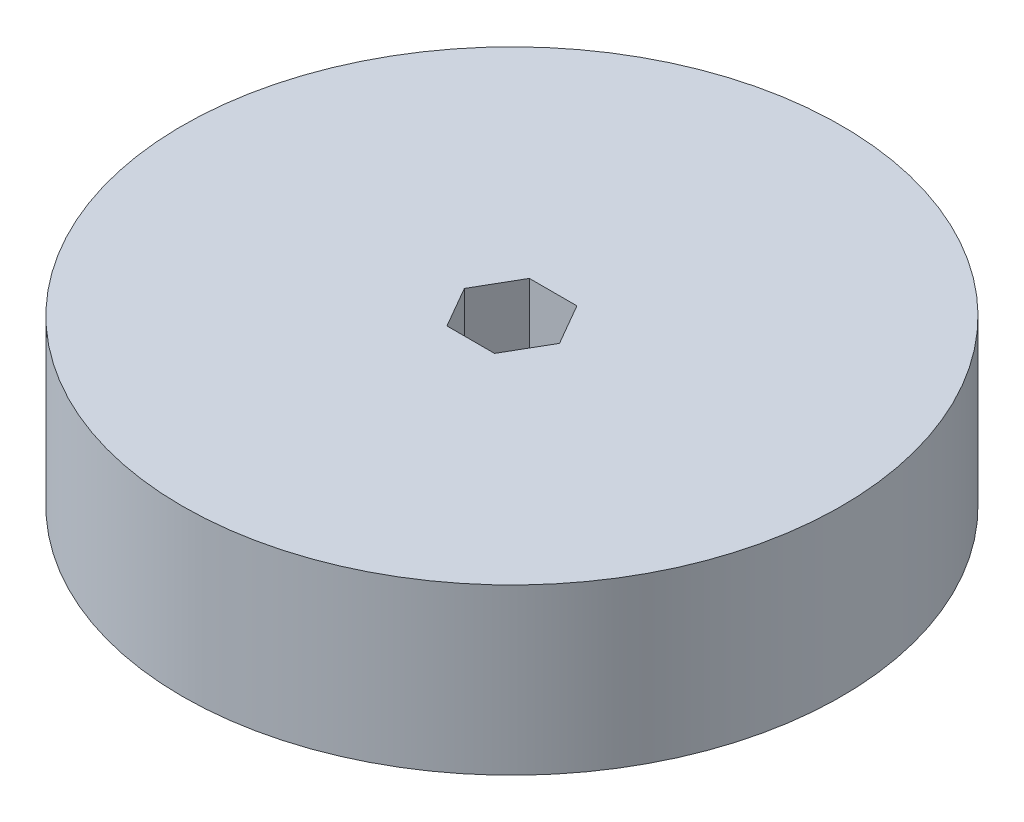
from build123d import *

# Parameters (mm, degrees)
SKETCH1_R           = 50.8
BOSS_EXTRUDE1_DEPTH = 25.4


with BuildPart() as part:
    # Sketch1 → Boss-Extrude1 (new body)
    with BuildSketch(Plane(origin=(0, 0, 0), x_dir=(1, 0, 0), z_dir=(0, 1, 0))):
        with Locations(Location((0, 0, 0), (0, 0, 270))):
            Circle(SKETCH1_R)
        Polygon((3.666174209, -6.35), (7.332348419, 0), (3.666174209, 6.35), (-3.666174209, 6.35), (-7.332348419, 0), (-3.666174209, -6.35), align=None, mode=Mode.SUBTRACT)
    extrude(amount=BOSS_EXTRUDE1_DEPTH)


solid = part.part
